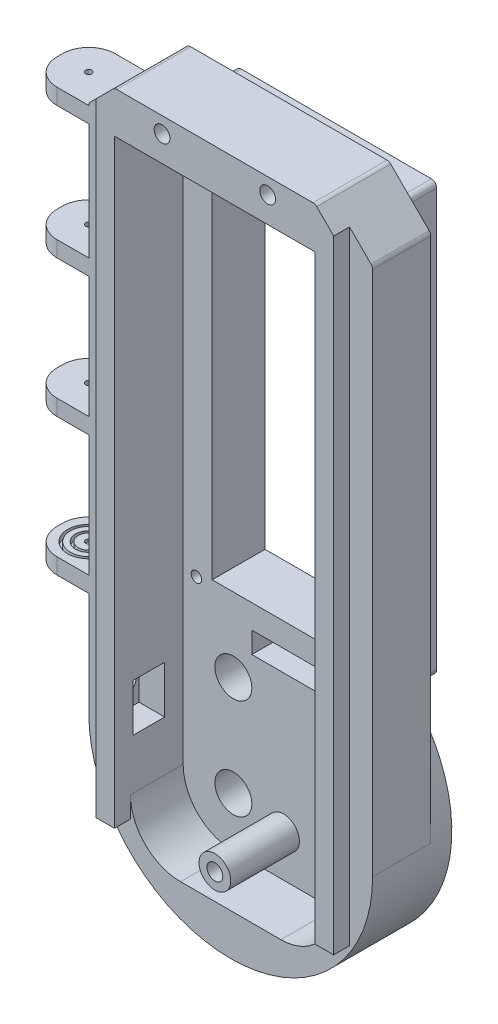
from build123d import *

# Parameters (mm, degrees)
CROQUIS1_W               = 38
CROQUIS1_H               = 81
CROQUIS1_W_2             = 27
CROQUIS1_H_2             = 72
CROQUIS1_H_3             = 38
CROQUIS1_R               = 3.5
SALIENTE_EXTRUIR1_DEPTH  = 5
CROQUIS2_W               = 38
CROQUIS2_H               = 81
CROQUIS2_W_2             = 27
CROQUIS2_H_2             = 72
SALIENTE_EXTRUIR2_DEPTH  = 5
SALIENTE_EXTRUIR9_START  = -1
SALIENTE_EXTRUIR9_DEPTH  = 1
SALIENTE_EXTRUIR10_DEPTH = 11
SALIENTE_EXTRUIR11_DEPTH = 10
REDONDEO1_R              = 1
REDONDEO2_R              = 1
REDONDEO3_R              = 1
CROQUIS6_W               = 6
CROQUIS6_H               = 9
CORTAR_EXTRUIR1_DEPTH    = 8
CROQUIS7_W               = 6
CROQUIS7_H               = 9
CROQUIS7_R               = 2.5
SALIENTE_EXTRUIR12_DEPTH = 3
SALIENTE_EXTRUIR13_DEPTH = 11
REDONDEO4_R              = 5
CROQUIS9_R               = 0.6
CORTAR_EXTRUIR2_DEPTH    = 80
SALIENTE_EXTRUIR14_START = -2.5
CROQUIS10_R              = 0.6
SALIENTE_EXTRUIR14_DEPTH = 2.5
CROQUIS11_R              = 4
CROQUIS11_R_2            = 3.5
CROQUIS11_R_3            = 2.5
CROQUIS11_R_4            = 2
CORTAR_EXTRUIR3_DEPTH    = 1
SALIENTE_EXTRUIR15_DEPTH = 3
CROQUIS14_R              = 1.5
CORTAR_EXTRUIR4_DEPTH    = 14
CROQUIS16_W              = 3.5
CROQUIS16_H              = 3
SALIENTE_EXTRUIR16_DEPTH = 4
CROQUIS25_R              = 3
CROQUIS25_R_2            = 1.5
SALIENTE_EXTRUIR21_DEPTH = 18
CROQUIS26_R              = 1.5
CORTAR_EXTRUIR7_DEPTH    = 18
CROQUIS28_R              = 1
CORTAR_EXTRUIR8_DEPTH    = 4
CROQUIS29_W              = 16
CROQUIS29_H              = 4
CORTAR_EXTRUIR9_DEPTH    = 5


with BuildPart() as part:
    # Croquis1 → Saliente-Extruir1 (new body)
    # profile 1 of 5: a face of its own
    with BuildSketch(Plane.XY):
        Rectangle(CROQUIS1_W, CROQUIS1_H)
        Rectangle(CROQUIS1_W_2, CROQUIS1_H_2, mode=Mode.SUBTRACT)
    # profile 2 of 5: a face of its own
    with BuildSketch(Plane.XY):
        with Locations((0, -59.5)):
            Rectangle(CROQUIS1_W, CROQUIS1_H_3)
        with Locations((-9.5, -69)):
            Circle(CROQUIS1_R, mode=Mode.SUBTRACT)
        with Locations((9.5, -59.5)):
            Circle(CROQUIS1_R, mode=Mode.SUBTRACT)
        with Locations((-9.5, -50)):
            Circle(CROQUIS1_R, mode=Mode.SUBTRACT)
    # profile 3 of 5: a face of its own
    with BuildSketch(Plane.XY):
        with BuildLine():
            ThreePointArc((19, -78.5), (26.870057685, -59.5), (19, -40.5))
            Line((19, -40.5), (19, -78.5))
        make_face()
    # profile 4 of 5: a face of its own
    with BuildSketch(Plane.XY):
        with BuildLine():
            Line((19, -78.5), (-19, -78.5))
            ThreePointArc((-19, -78.5), (0, -86.370057685), (19, -78.5))
        make_face()
    # profile 5 of 5: a face of its own
    with BuildSketch(Plane.XY):
        with BuildLine():
            Line((-19, -78.5), (-19, -40.5))
            ThreePointArc((-19, -40.5), (-26.870057685, -59.5), (-19, -78.5))
        make_face()
    extrude(amount=SALIENTE_EXTRUIR1_DEPTH)

    # Croquis2 → Saliente-Extruir2 (add)
    with BuildSketch(Plane(origin=(0, 0, 0), x_dir=(-1, 0, 0), z_dir=(0, 0, -1))):
        Rectangle(CROQUIS2_W, CROQUIS2_H)
        Rectangle(CROQUIS2_W_2, CROQUIS2_H_2, mode=Mode.SUBTRACT)
    extrude(amount=SALIENTE_EXTRUIR2_DEPTH)

    # Croquis3 → Saliente-Extruir9 (add)
    with BuildSketch(Plane.XY.offset(5).offset(SALIENTE_EXTRUIR9_START)):
        with BuildLine():
            Line((26.870057685, -59.5), (26.870057685, 40.5))
            Line((26.870057685, 40.5), (19, 48.370057685))
            Line((19, 48.370057685), (-19, 48.370057685))
            Line((-19, 48.370057685), (-26.870057685, 40.5))
            Line((-26.870057685, 40.5), (-26.870057685, -59.5))
            ThreePointArc((-26.870057685, -59.5), (0, -86.370057685), (26.870057685, -59.5))
        make_face()
        with BuildLine():
            Line((19, -59.5), (19, 40.5))
            Line((19, 40.5), (-19, 40.5))
            Line((-19, 40.5), (-19, -59.5))
            ThreePointArc((-19, -59.5), (0, -78.5), (19, -59.5))
        make_face(mode=Mode.SUBTRACT)
    extrude(amount=SALIENTE_EXTRUIR9_DEPTH)

    # Croquis4 → Saliente-Extruir10 (add)
    with BuildSketch(Plane(origin=(0, 0, 4), x_dir=(-1, 0, 0), z_dir=(0, 0, -1))):
        with BuildLine():
            Line((19, 40.5), (19, -40.5))
            ThreePointArc((19, -40.5), (24.824696333, -49.217274097), (26.870057685, -59.5))
            Line((26.870057685, -59.5), (26.870057685, 40.5))
            Line((26.870057685, 40.5), (19, 48.370057685))
            Line((19, 48.370057685), (-19, 48.370057685))
            Line((-19, 48.370057685), (-26.870057685, 40.5))
            Line((-26.870057685, 40.5), (-26.870057685, -59.5))
            ThreePointArc((-26.870057685, -59.5), (-24.824696333, -49.217274097), (-19, -40.5))
            Line((-19, -40.5), (-19, 40.5))
            Line((-19, 40.5), (19, 40.5))
        make_face()
    extrude(amount=-SALIENTE_EXTRUIR10_DEPTH)

    # Croquis5 → Saliente-Extruir11 (add)
    with BuildSketch(Plane.XY.offset(5)):
        with BuildLine():
            Line((-19, -59.5), (-19, -69))
            ThreePointArc((-19, -69), (-16.217514421, -75.717514421), (-9.5, -78.5))
            Line((-9.5, -78.5), (9.5, -78.5))
            ThreePointArc((9.5, -78.5), (16.217514421, -75.717514421), (19, -69))
            Line((19, -69), (19, -59.5))
            Line((19, -59.5), (19, -40.5))
            ThreePointArc((19, -40.5), (0, -86.370057685), (-19, -40.5))
            Line((-19, -40.5), (-19, -59.5))
        make_face()
    extrude(amount=SALIENTE_EXTRUIR11_DEPTH)

    # Redondeo1
    redondeo1_edges = [part.edges().sort_by_distance(p)[0] for p in [
        (19, -40.5, -2.5),
        (-19, -40.5, -2.5),
        (19, 40.5, -0.5),
        (-19, 40.5, -0.5),
    ]]
    fillet(redondeo1_edges, radius=REDONDEO1_R)

    # Redondeo2
    redondeo2_edges = [part.edges().sort_by_distance(p)[0] for p in [
        (-19, -0.5, 4),
        (0, 40.5, 4),
        (-18.707106781, 40.207106781, 4),
        (18.707106781, 40.207106781, 4),
        (19, -0.5, 4),
    ]]
    fillet(redondeo2_edges, radius=REDONDEO2_R)

    # Redondeo3
    redondeo3_edges = [part.edges().sort_by_distance(p)[0] for p in [
        (19, 48.370057685, 9.5),
        (26.870057685, 40.5, 9.5),
        (-26.870057685, 40.5, 9.5),
        (-19, 48.370057685, 9.5),
    ]]
    fillet(redondeo3_edges, radius=REDONDEO3_R)

    # Croquis6 → Cortar-Extruir1 (cut)
    with BuildSketch(Plane.ZY.offset(26.870057685)):
        with Locations((11.5, -55)):
            Rectangle(CROQUIS6_W, CROQUIS6_H)
    extrude(amount=-CORTAR_EXTRUIR1_DEPTH, mode=Mode.SUBTRACT)

    # Croquis7 → Saliente-Extruir12 (add)
    with BuildSketch(Plane.ZY.offset(26.870057685)):
        with Locations((11.5, -55)):
            Rectangle(CROQUIS7_W, CROQUIS7_H)
        with Locations((11.5, -55)):
            Circle(CROQUIS7_R, mode=Mode.SUBTRACT)
    extrude(amount=-SALIENTE_EXTRUIR12_DEPTH)

    # Croquis8 → Saliente-Extruir13 (add)
    with BuildSketch(Plane.ZY.offset(26.870057685)):
        Polygon((15, 40.085786438), (4, 40.085786438), (4, 37.085786438), (9.5, 37.085786438), (15, 37.085786438), align=None)
        Polygon((9.5, 15.085786438), (4, 15.085786438), (4, 12.085786438), (9.5, 12.085786438), (15, 12.085786438), (15, 15.085786438), align=None)
        Polygon((9.5, -10.914213562), (4, -10.914213562), (4, -13.914213562), (9.5, -13.914213562), (15, -13.914213562), (15, -10.914213562), align=None)
        Polygon((9.5, -36.914213562), (4, -36.914213562), (4, -39.914213562), (15, -39.914213562), (15, -36.914213562), align=None)
    extrude(amount=SALIENTE_EXTRUIR13_DEPTH)

    # Redondeo4
    redondeo4_edges = [part.edges().sort_by_distance(p)[0] for p in [
        (-37.870057685, 38.585786438, 4),
        (-37.870057685, 38.585786438, 15),
        (-37.870057685, 13.585786438, 4),
        (-37.870057685, 13.585786438, 15),
        (-37.870057685, -12.414213562, 4),
        (-37.870057685, -12.414213562, 15),
        (-37.870057685, -38.414213562, 4),
        (-37.870057685, -38.414213562, 15),
    ]]
    fillet(redondeo4_edges, radius=REDONDEO4_R)

    # Croquis9 → Cortar-Extruir2 (cut)
    with BuildSketch(Plane(origin=(0, 40.085786438, 0), x_dir=(1, 0, 0), z_dir=(0, 1, 0))):
        with Locations(Location((-32.370057685, -9.5, 0), (0, 0, 270))):
            Circle(CROQUIS9_R)
    extrude(amount=-CORTAR_EXTRUIR2_DEPTH, mode=Mode.SUBTRACT)

    # Croquis10 → Saliente-Extruir14 (add)
    with BuildSketch(Plane.XZ.offset(39.914213562).offset(SALIENTE_EXTRUIR14_START)):
        with Locations(Location((-32.370057685, 9.5, 0), (0, 0, 90))):
            Circle(CROQUIS10_R)
    extrude(amount=SALIENTE_EXTRUIR14_DEPTH)

    # Croquis11 → Cortar-Extruir3 (cut)
    # profile 1 of 2: a face of its own
    with BuildSketch(Plane(origin=(0, -36.914213562, 0), x_dir=(1, 0, 0), z_dir=(0, 1, 0))):
        with Locations(Location((-32.370057685, -9.5, 0), (0, 0, 270))):
            Circle(CROQUIS11_R)
        with Locations(Location((-32.370057685, -9.5, 0), (0, 0, 270))):
            Circle(CROQUIS11_R_2, mode=Mode.SUBTRACT)
    # profile 2 of 2: a face of its own
    with BuildSketch(Plane(origin=(0, -36.914213562, 0), x_dir=(1, 0, 0), z_dir=(0, 1, 0))):
        with Locations(Location((-32.370057685, -9.5, 0), (0, 0, 270))):
            Circle(CROQUIS11_R_3)
        with Locations(Location((-32.370057685, -9.5, 0), (0, 0, 270))):
            Circle(CROQUIS11_R_4, mode=Mode.SUBTRACT)
    extrude(amount=-CORTAR_EXTRUIR3_DEPTH, mode=Mode.SUBTRACT)

    # Croquis13 → Saliente-Extruir15 (add)
    with BuildSketch(Plane.XY.offset(15)):
        Polygon((-19, -65.5), (-19, 40.5), (-22.5, 40.5), (-22.5, -69), (-19, -69), align=None)
        Polygon((22.5, 40.5), (19, 40.5), (19, -65.5), (19, -69), (22.5, -69), align=None)
        with BuildLine():
            Line((-19, 40.5), (19, 40.5))
            Line((19, 40.5), (22.5, 40.5))
            Line((22.5, 40.5), (22.5, 44.870057685))
            Line((22.5, 44.870057685), (19.292893219, 48.077164466))
            ThreePointArc((19.292893219, 48.077164466), (18.96846987, 48.293937218), (18.585786438, 48.370057685))
            Line((18.585786438, 48.370057685), (-18.585786438, 48.370057685))
            ThreePointArc((-18.585786438, 48.370057685), (-18.96846987, 48.293937218), (-19.292893219, 48.077164466))
            Line((-19.292893219, 48.077164466), (-22.5, 44.870057685))
            Line((-22.5, 44.870057685), (-22.5, 40.5))
            Line((-22.5, 40.5), (-19, 40.5))
        make_face()
    extrude(amount=SALIENTE_EXTRUIR15_DEPTH)

    # Croquis14 → Cortar-Extruir4 (cut)
    with BuildSketch(Plane(origin=(0, 0, 4), x_dir=(-1, 0, 0), z_dir=(0, 0, -1))):
        with Locations((10, 45.370057685)):
            Circle(CROQUIS14_R)
        with Locations(Location((-10, 45.370057685, 0), (0, 0, 180))):
            Circle(CROQUIS14_R)
    extrude(amount=-CORTAR_EXTRUIR4_DEPTH, mode=Mode.SUBTRACT)

    # Croquis16 → Saliente-Extruir16 (add)
    with BuildSketch(Plane(origin=(0, -69, 0), x_dir=(-1, 0, 0), z_dir=(0, -1, 0))):
        with Locations((20.75, -16.5)):
            Rectangle(CROQUIS16_W, CROQUIS16_H)
        with Locations((-20.75, -16.5)):
            Rectangle(CROQUIS16_W, CROQUIS16_H)
    extrude(amount=SALIENTE_EXTRUIR16_DEPTH)

    # Croquis25 → Saliente-Extruir21 (add)
    with BuildSketch(Plane.XY.offset(18)):
        with Locations((0, -70.629942315)):
            Circle(CROQUIS25_R)
        with Locations((0, -70.629942315)):
            Circle(CROQUIS25_R_2, mode=Mode.SUBTRACT)
    extrude(amount=-SALIENTE_EXTRUIR21_DEPTH)

    # Croquis26 → Cortar-Extruir7 (cut)
    with BuildSketch(Plane.XY.offset(18)):
        with Locations((0, -70.629942315)):
            Circle(CROQUIS26_R)
    extrude(amount=-CORTAR_EXTRUIR7_DEPTH, mode=Mode.SUBTRACT)

    # Croquis28 → Cortar-Extruir8 (cut)
    with BuildSketch(Plane.XY.offset(5)):
        with Locations((-16.5, 38)):
            Circle(CROQUIS28_R)
        with Locations((14.5, 38)):
            Circle(CROQUIS28_R)
        with Locations((14.5, -37)):
            Circle(CROQUIS28_R)
        with Locations((-16.5, -37)):
            Circle(CROQUIS28_R)
    extrude(amount=-CORTAR_EXTRUIR8_DEPTH, mode=Mode.SUBTRACT)

    # Croquis29 → Cortar-Extruir9 (cut)
    with BuildSketch(Plane.XY.offset(5)):
        with Locations((2, -42.5)):
            Rectangle(CROQUIS29_W, CROQUIS29_H)
    extrude(amount=-CORTAR_EXTRUIR9_DEPTH, mode=Mode.SUBTRACT)


solid = part.part
